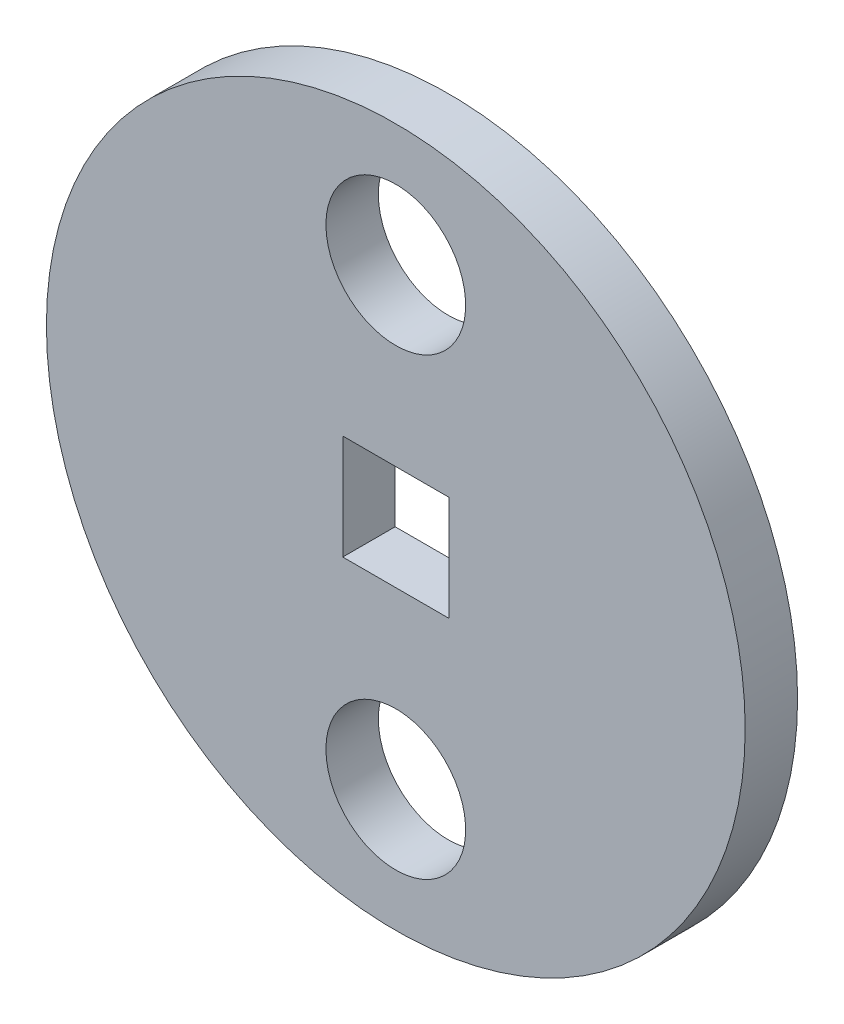
from build123d import *

# Parameters (mm, degrees)
SKETCH1_R           = 25.4
SKETCH1_R_2         = 5.08
SKETCH1_W           = 7.710600268
SKETCH1_H           = 7.62
BOSS_EXTRUDE1_DEPTH = 3.81


with BuildPart() as part:
    # Sketch1 → Boss-Extrude1 (new body)
    with BuildSketch(Plane.XY):
        with Locations(Location((0, 0, 0), (0, 0, 180))):
            Circle(SKETCH1_R)
        with Locations(Location((0, 16.51, 0), (0, 0, 180))):
            Circle(SKETCH1_R_2, mode=Mode.SUBTRACT)
        with Locations(Location((0, -16.51, 0), (0, 0, 180))):
            Circle(SKETCH1_R_2, mode=Mode.SUBTRACT)
        Rectangle(SKETCH1_W, SKETCH1_H, mode=Mode.SUBTRACT)
    extrude(amount=BOSS_EXTRUDE1_DEPTH)


solid = part.part
